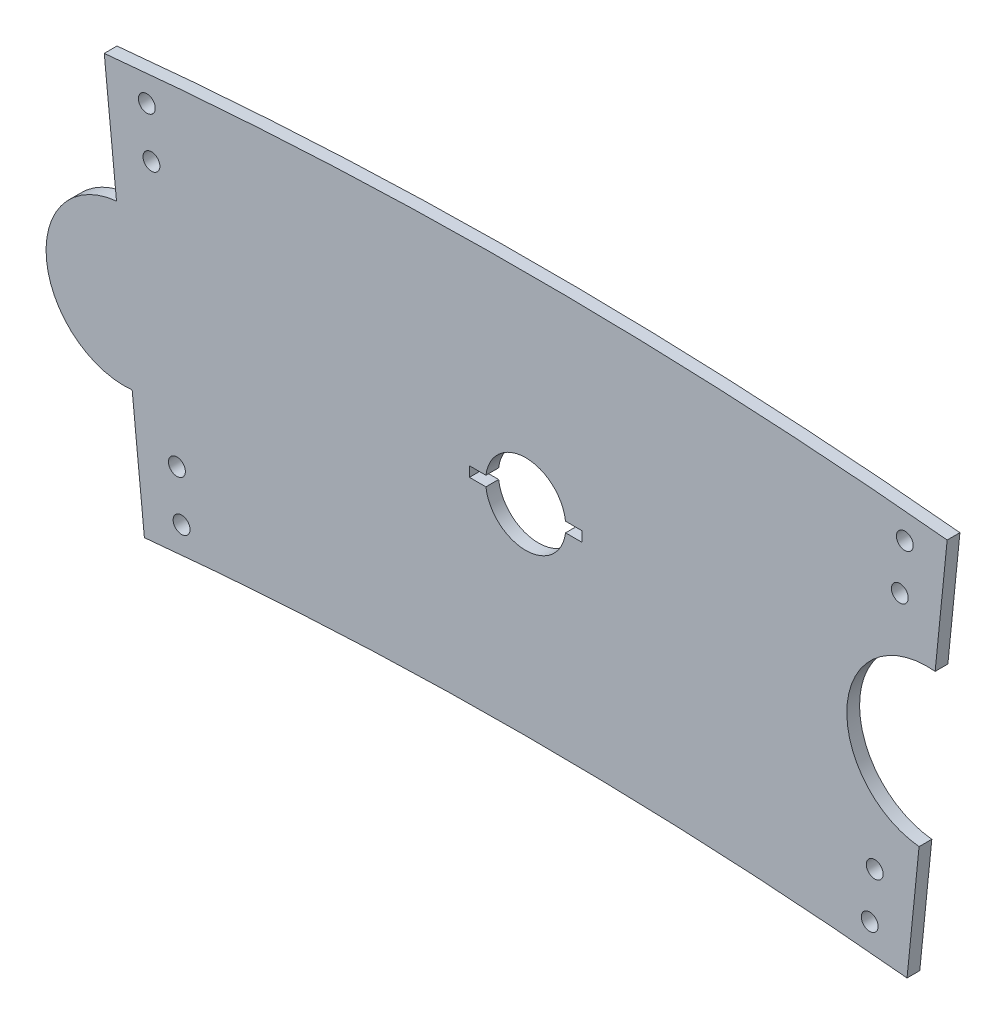
from build123d import *

# Parameters (mm, degrees)
BOSS_EXTRUDE1_DEPTH = 3.175
SKETCH3_R           = 2.1
CUT_EXTRUDE1_DEPTH  = 10


with BuildPart() as part:
    # Sketch1 → Boss-Extrude1 (new body)
    with BuildSketch(Plane.XY):
        with BuildLine():
            Line((-105, 44.736808962), (-101.95, 14.38969213))
            ThreePointArc((-101.95, 14.38969213), (-119.402255024, -6.962562893), (-98.05, -24.414817917))
            Line((-98.05, -24.414817917), (-95, -54.761934749))
            ThreePointArc((-95, -54.761934749), (0, -50), (95, -54.761934749))
            Line((95, -54.761934749), (98, -24.912311636))
            ThreePointArc((98, -24.912311636), (80.100251258, -3.012562893), (102, 14.887185849))
            Line((102, 14.887185849), (105, 44.736808962))
            ThreePointArc((105, 44.736808962), (0, 50), (-105, 44.736808962))
        make_face()
        with BuildLine():
            Line((-14.021567416, 1.25), (-9.921567416, 1.25))
            ThreePointArc((-9.921567416, 1.25), (0, 10), (9.921567416, 1.25))
            Line((9.921567416, 1.25), (14.021567416, 1.25))
            Line((14.021567416, 1.25), (14.021567416, -1.25))
            Line((14.021567416, -1.25), (9.921567416, -1.25))
            ThreePointArc((9.921567416, -1.25), (0, -10), (-9.921567416, -1.25))
            Line((-9.921567416, -1.25), (-14.021567416, -1.25))
            Line((-14.021567416, -1.25), (-14.021567416, 1.25))
        make_face(mode=Mode.SUBTRACT)
    extrude(amount=BOSS_EXTRUDE1_DEPTH)

    # Sketch3 → Cut-Extrude1 (cut)
    with BuildSketch(Plane.XY.offset(3.175)):
        with Locations((-94.396840498, 39.233865601)):
            Circle(SKETCH3_R)
        with Locations((-93.239490742, 27.289806762)):
            Circle(SKETCH3_R)
        with Locations((-86.896840498, -35.390192182)):
            Circle(SKETCH3_R)
        with Locations((-85.739490742, -47.334251021)):
            Circle(SKETCH3_R)
        with Locations((85.70397559, -47.259048155)):
            Circle(SKETCH3_R)
        with Locations((86.946610528, -35.3235608)):
            Circle(SKETCH3_R)
        with Locations((93.20397559, 27.365009628)):
            Circle(SKETCH3_R)
        with Locations((94.446610528, 39.300496983)):
            Circle(SKETCH3_R)
    extrude(amount=-CUT_EXTRUDE1_DEPTH, mode=Mode.SUBTRACT)


solid = part.part
